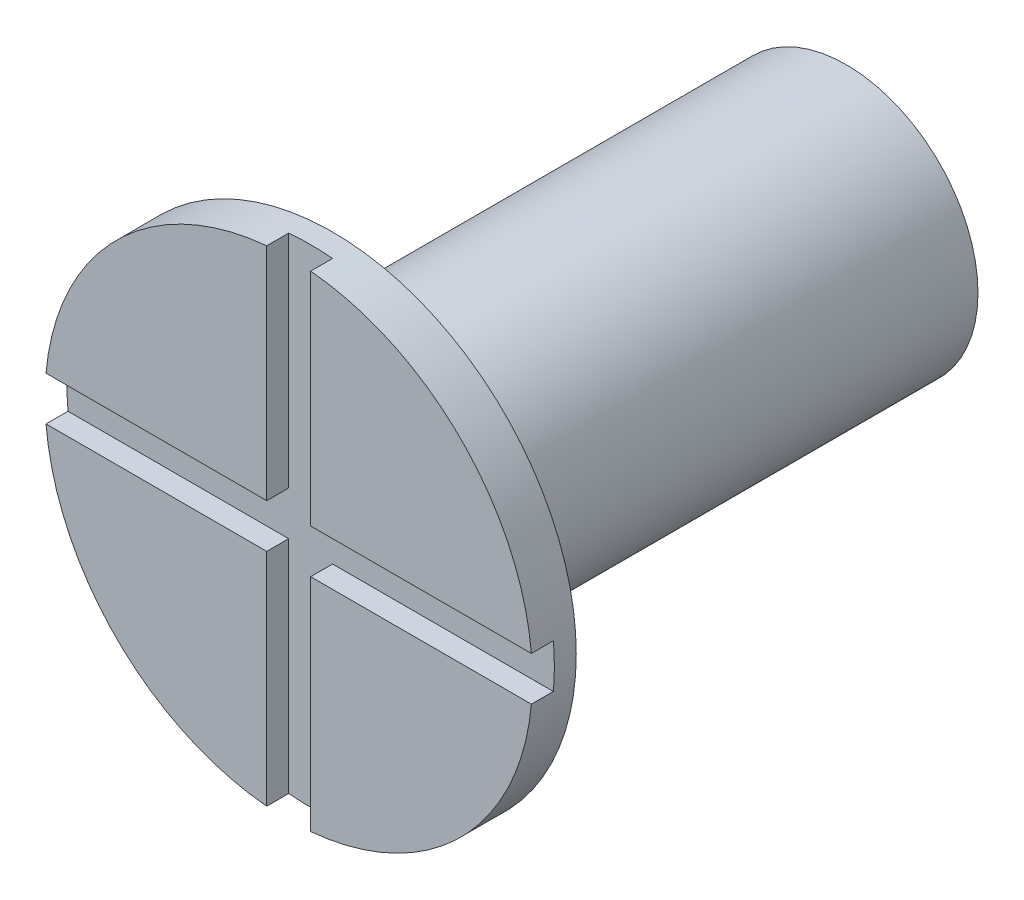
from build123d import *

# Parameters (mm, degrees)
SKETCH1_R               = 1.5
BOSS_EXTRUDE1_DEPTH     = 6.35
SKETCH3_R               = 2.775
BOSS_EXTRUDE3_DEPTH     = 0.5
SKETCH4_W               = 0.5
SKETCH4_H               = 6.00854879
SKETCH4_W_2             = 6.00854879
SKETCH4_H_2             = 0.5
CUT_EXTRUDE_THIN1_DEPTH = 0.25


with BuildPart() as part:
    # Sketch1 → Boss-Extrude1 (new body)
    with BuildSketch(Plane.XY):
        Circle(SKETCH1_R)
    extrude(amount=BOSS_EXTRUDE1_DEPTH)

    # Sketch3 → Boss-Extrude3 (add)
    with BuildSketch(Plane.XY.offset(6.35)):
        Circle(SKETCH3_R)
    extrude(amount=-BOSS_EXTRUDE3_DEPTH)

    # Sketch4 → Cut-Extrude-Thin1 (cut)
    with BuildSketch(Plane.XY.offset(6.35)):
        Rectangle(SKETCH4_W, SKETCH4_H)
        Rectangle(SKETCH4_W_2, SKETCH4_H_2)
    extrude(amount=-CUT_EXTRUDE_THIN1_DEPTH, mode=Mode.SUBTRACT)


solid = part.part
